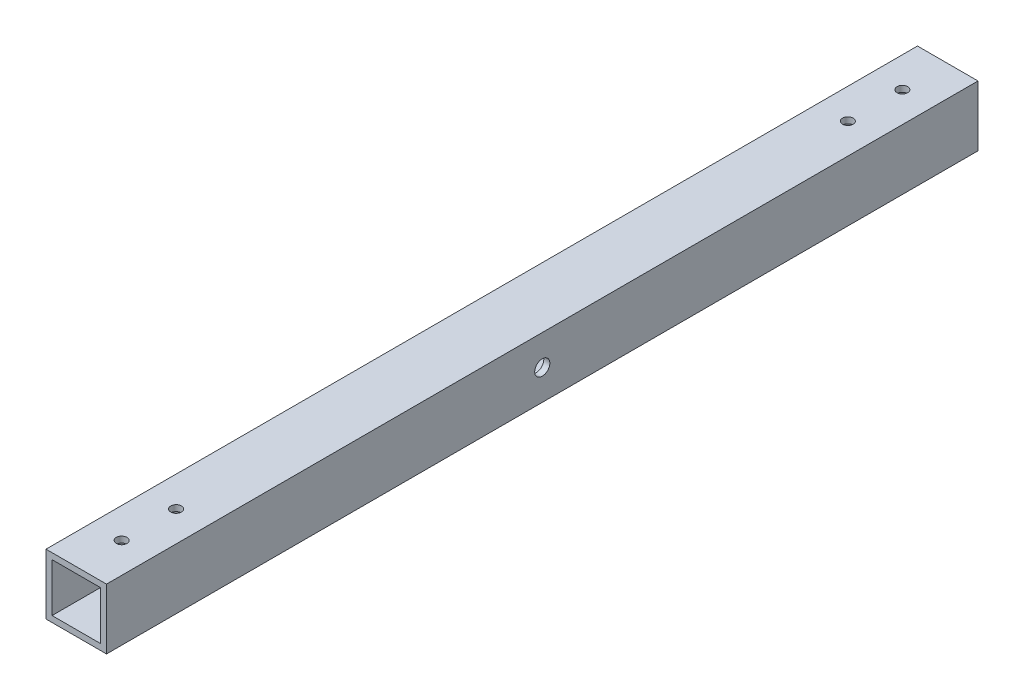
from build123d import *

# Parameters (mm, degrees)
BOSS_EXTRUDE1_DEPTH      = 457.2
BOSS_EXTRUDE1_DEPTH_BACK = 457.2
SKETCH3_W                = 63.5
SKETCH3_H                = 63.5
SKETCH3_W_2              = 50.8
SKETCH3_H_2              = 50.8
SKETCH6_R                = 5.588
CUT_EXTRUDE1_DEPTH       = 463.679319291
SKETCH7_R                = 7.9375
CUT_EXTRUDE2_DEPTH       = 463.679319291


with BuildPart() as part:
    # Sketch3 → Boss-Extrude1 (new, two sides: drawn at the far end of the back side and taken through both)
    with BuildSketch(Plane.XY.offset(-BOSS_EXTRUDE1_DEPTH_BACK)):
        Rectangle(SKETCH3_W, SKETCH3_H)
        Rectangle(SKETCH3_W_2, SKETCH3_H_2, mode=Mode.SUBTRACT)
    extrude(amount=BOSS_EXTRUDE1_DEPTH + BOSS_EXTRUDE1_DEPTH_BACK)

    # Sketch6 → Cut-Extrude1 (cut, through all)
    with BuildSketch(Plane(origin=(0, 31.75, 0), x_dir=(1, 0, 0), z_dir=(0, 1, 0))):
        with Locations(Location((0, 409.575, 0), (0, 0, 270))):
            Circle(SKETCH6_R)
        with Locations(Location((0, -409.575, 0), (0, 0, 270))):
            Circle(SKETCH6_R)
        with Locations(Location((0, -352.425, 0), (0, 0, 270))):
            Circle(SKETCH6_R)
        with Locations(Location((0, 352.425, 0), (0, 0, 270))):
            Circle(SKETCH6_R)
    extrude(amount=-CUT_EXTRUDE1_DEPTH, mode=Mode.SUBTRACT)

    # Sketch7 → Cut-Extrude2 (cut, through all)
    with BuildSketch(Plane(origin=(31.75, 0, 0), x_dir=(0, 0, -1), z_dir=(1, 0, 0))):
        Circle(SKETCH7_R)
    extrude(amount=-CUT_EXTRUDE2_DEPTH, mode=Mode.SUBTRACT)


solid = part.part
